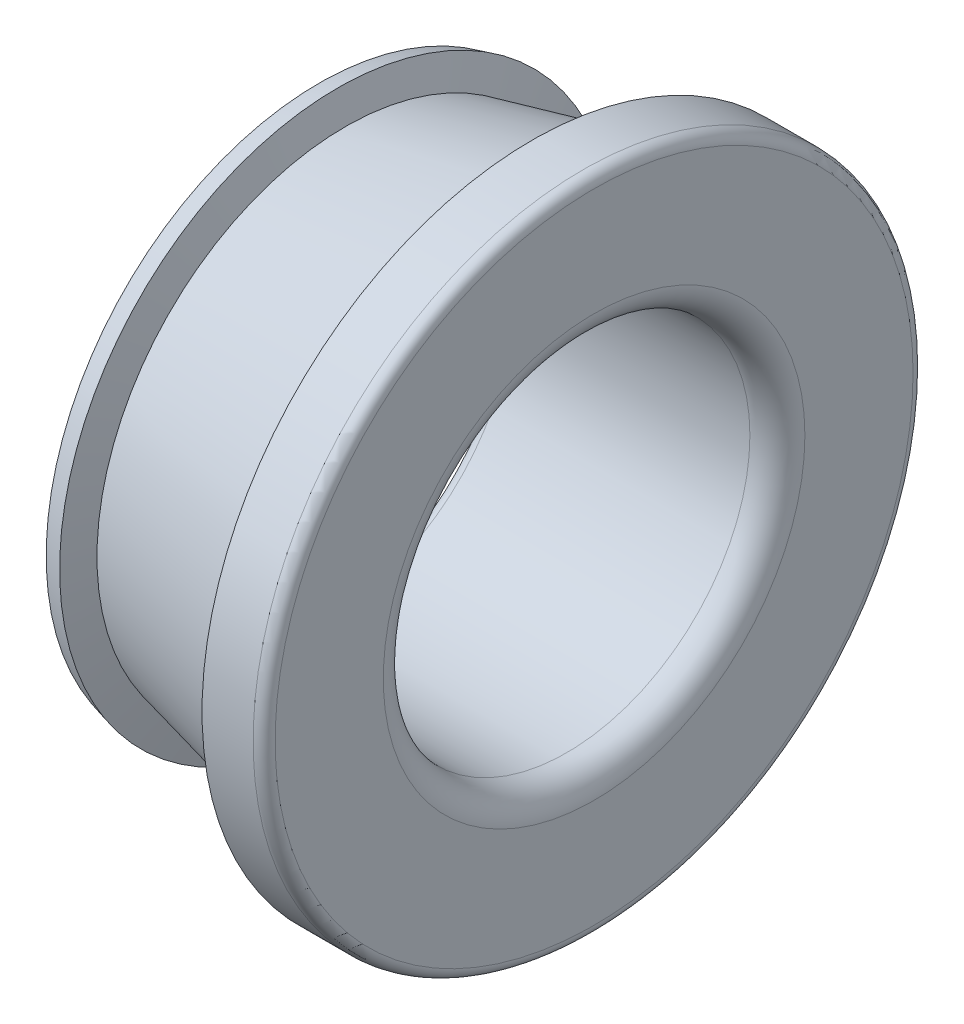
from build123d import *


with BuildPart() as part:
    # Esquisse1 → Base-Révolution (revolve)
    with BuildSketch(Plane.XY, mode=Mode.PRIVATE) as base_r_volution_sk:
        with BuildLine():
            Line((0, 11.5), (0, 17.4))
            ThreePointArc((0, 17.4), (-0.175735931, 17.824264069), (-0.6, 18))
            Line((-0.6, 18), (-3.385649604, 18))
            Line((-3.385649604, 18), (-2.868011513, 16.068148347))
            Line((-2.868011513, 16.068148347), (-13.569257226, 13.548339466))
            Line((-13.569257226, 13.548339466), (-14, 15.155893383))
            Line((-14, 15.155893383), (-15, 14.887944191))
            Line((-15, 14.887944191), (-15, 10.6))
            ThreePointArc((-15, 10.6), (-14.824264069, 10.175735931), (-14.4, 10))
            Line((-14.4, 10), (-1.5, 10))
            ThreePointArc((-1.5, 10), (-0.439339828, 10.439339828), (0, 11.5))
        make_face()
    revolve(base_r_volution_sk.sketch.rotate(Axis((0, 0, 0), (-1, 0, 0)), 90), axis=Axis((0, 0, 0), (-1, 0, 0)))


solid = part.part
